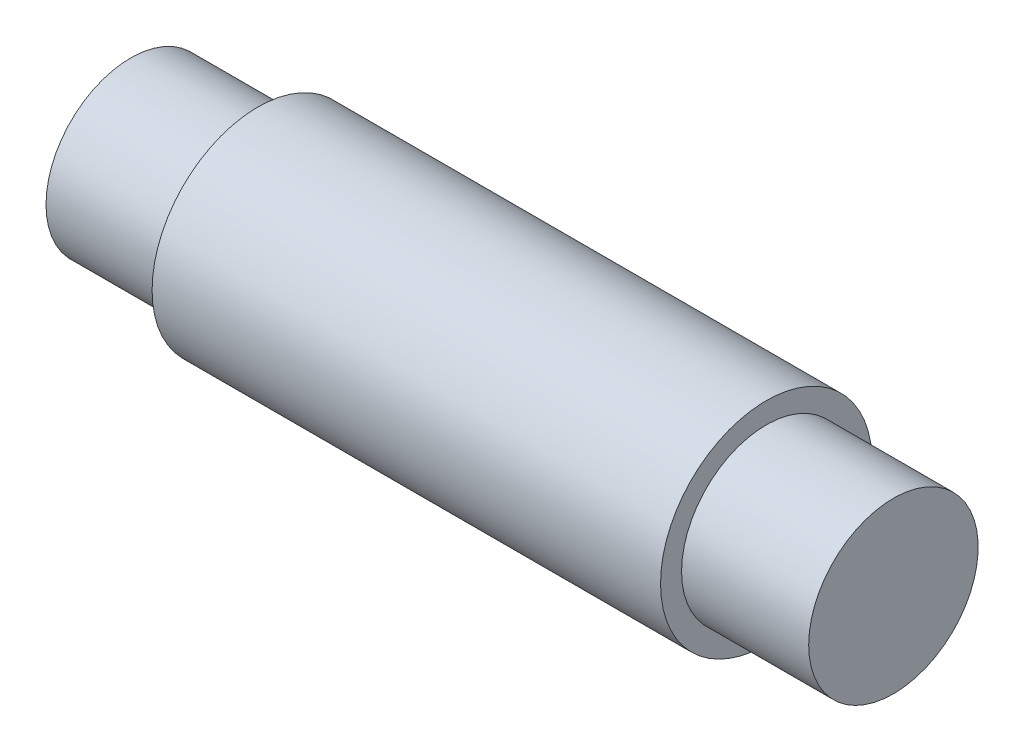
from build123d import *


with BuildPart() as part:
    # Sketch1 → Revolve1 (revolve)
    with BuildSketch(Plane.XY, mode=Mode.PRIVATE) as revolve1_sk:
        Polygon((0, 0), (28.575, 0), (28.575, 3.175), (23.8125, 3.175), (23.8125, 3.9624), (4.7625, 3.9624), (4.7625, 3.175), (0, 3.175), align=None)
    revolve(revolve1_sk.sketch.rotate(Axis((0, 0, 0), (1, 0, 0)), 90), axis=Axis((0, 0, 0), (1, 0, 0)))


solid = part.part
